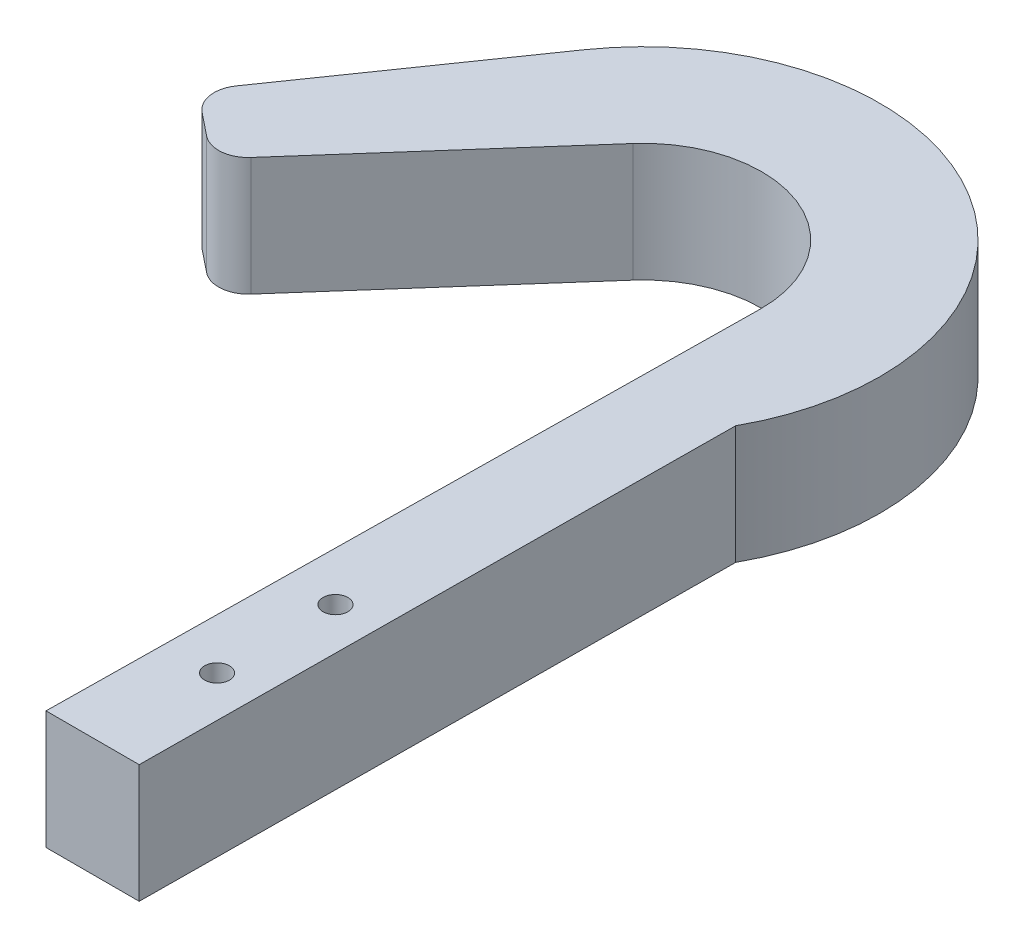
from build123d import *

# Parameters (mm, degrees)
BOSS_EXTRUDE1_DEPTH = 25.4
SKETCH2_R           = 2.667
CUT_EXTRUDE1_DEPTH  = 25.4


with BuildPart() as part:
    # Sketch1 → Boss-Extrude1 (new body)
    with BuildSketch(Plane(origin=(0, 0, 0), x_dir=(1, 0, 0), z_dir=(0, 1, 0))):
        with BuildLine():
            Line((-73.81674099, -45.828335303), (-53.81674099, -45.828335303))
            Line((-53.81674099, -45.828335303), (-52.796976786, 81.171664697))
            ThreePointArc((-52.796976786, 81.171664697), (-70.408048373, 148.917605355), (-138.959581609, 134.763114577))
            Line((-138.959581609, 134.763114577), (-169.546861653, 90.731300142))
            ThreePointArc((-169.546861653, 90.731300142), (-170.615608999, 86.194762182), (-168.299108962, 82.150479165))
            Line((-168.299108962, 82.150479165), (-163.411771612, 78.239641616))
            ThreePointArc((-163.411771612, 78.239641616), (-158.893349235, 76.871631311), (-154.679488648, 79.000239288))
            Line((-154.679488648, 79.000239288), (-116.297746729, 122.570612572))
            ThreePointArc((-116.297746729, 122.570612572), (-88.109701276, 129.483790907), (-71.840430534, 105.449049996))
            Line((-71.840430534, 105.449049996), (-73.81674099, -45.828335303))
        make_face()
    extrude(amount=BOSS_EXTRUDE1_DEPTH)

    # Sketch2 → Cut-Extrude1 (cut)
    with BuildSketch(Plane(origin=(0, 0, 0), x_dir=(-1, 0, 0), z_dir=(0, -1, 0))):
        with Locations(Location((62.503074737, 4.971664697, 0), (0, 0, 90))):
            Circle(SKETCH2_R)
        with Locations(Location((62.503074737, -20.428335303, 0), (0, 0, 90))):
            Circle(SKETCH2_R)
    extrude(amount=-CUT_EXTRUDE1_DEPTH, mode=Mode.SUBTRACT)


solid = part.part
